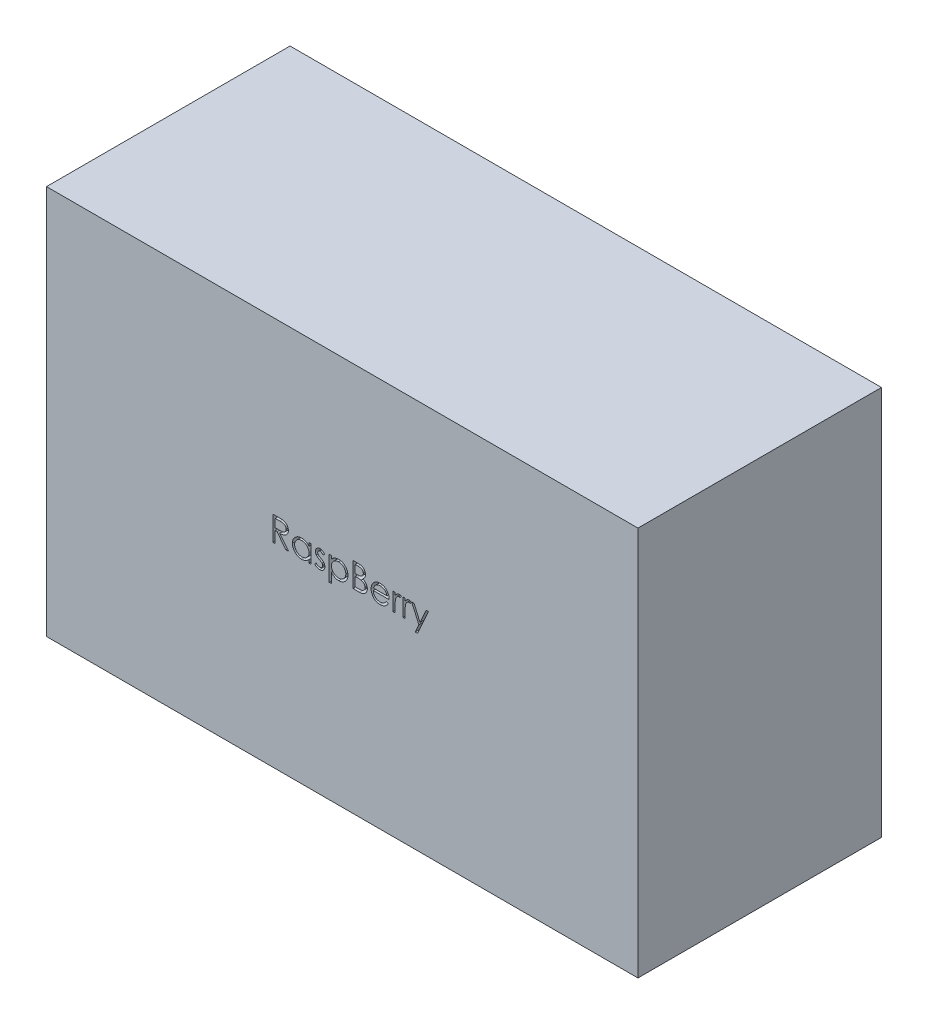
from build123d import *

# Parameters (mm, degrees)
CROQUIS1_W                 = 85
CROQUIS1_H                 = 56
SALIENTE_EXTRUIR2_DEPTH    = 17.5
CORTAR_EXTRUIR1_DEPTH      = 35
CORTAR_EXTRUIR1_DEPTH_BACK = 55


with BuildPart() as part:
    # Croquis1 → Saliente-Extruir2 (new, symmetric)
    with BuildSketch(Plane.XY):
        Rectangle(CROQUIS1_W, CROQUIS1_H)
    extrude(amount=SALIENTE_EXTRUIR2_DEPTH, both=True)

    # Croquis3 → Cortar-Extruir1 (cut, two sides: drawn at the far end of the back side and taken through both)
    # profile 1 of 9: a face of its own
    with BuildSketch(Plane.XY.offset(-CORTAR_EXTRUIR1_DEPTH_BACK)):
        with BuildLine():
            Line((-9.943123855, 3.5), (-9.242703182, 3.5))
            add(Edge.make_bspline(
                [(-9.242703182, 3.5), (-9.195962053, 3.499844414), (-9.106213909, 3.499545672), (-8.977640638, 3.497879909), (-8.860813541, 3.493105553), (-8.755793702, 3.48899697), (-8.662583047, 3.481505028), (-8.580895756, 3.474344381), (-8.511108059, 3.46497072), (-8.468862208, 3.456265297), (-8.449734432, 3.452323718)],
                knots=[0, 0, 0, 0, 1.410062039, 2.707475311, 3.878576406, 4.937260626, 5.877586885, 6.699081471, 7.410979367, 8, 8, 8, 8], degree=3))
            add(Edge.make_bspline(
                [(-8.449734432, 3.452323718), (-8.424127808, 3.445996953), (-8.373460818, 3.433478389), (-8.300510752, 3.407018788), (-8.230996428, 3.376399163), (-8.165206604, 3.340435443), (-8.103470813, 3.298860663), (-8.045152502, 3.252392541), (-7.989987038, 3.201285335), (-7.940205408, 3.144250494), (-7.893266357, 3.084413984), (-7.85367773, 3.019710227), (-7.81955125, 2.9520487), (-7.792380733, 2.880741282), (-7.77050276, 2.80647951), (-7.755076521, 2.728590713), (-7.745825333, 2.647429738), (-7.744883477, 2.59207183), (-7.744405906, 2.564002404)],
                knots=[0, 0, 0, 0, 1.027469482, 2.033020251, 3.019912614, 3.986113645, 4.951240523, 5.91722682, 6.890402269, 7.87763091, 8.8651537, 9.85103654, 10.82876324, 11.815024772, 12.821070561, 13.842952187, 14.906261191, 16, 16, 16, 16], degree=3))
            add(Edge.make_bspline(
                [(-7.744405906, 2.564002404), (-7.745874904, 2.517367299), (-7.7487413, 2.426370131), (-7.775466404, 2.29430925), (-7.819242923, 2.171119935), (-7.879566212, 2.056957297), (-7.956385688, 1.954046652), (-8.048710479, 1.863656197), (-8.156592091, 1.788016284), (-8.257021407, 1.735563479), (-8.345735606, 1.701970571), (-8.418768919, 1.678334212), (-8.498435897, 1.660072247), (-8.583973231, 1.643712115), (-8.675736887, 1.63136042), (-8.773506926, 1.622313826), (-8.877353078, 1.616659777), (-8.948692147, 1.615817772), (-8.985391483, 1.615384615)],
                knots=[0, 0, 0, 0, 1.260483769, 2.459530307, 3.627416485, 4.787058657, 5.939039949, 7.08810263, 8.267026773, 9.491475466, 10.141966685, 10.831826277, 11.566392101, 12.351337768, 13.187381173, 14.07005841, 15.007169909, 16, 16, 16, 16], degree=3))
            Line((-8.985391483, 1.615384615), (-7.699534111, 0))
            Line((-7.699534111, 0), (-8.087955586, 0))
            Line((-8.087955586, 0), (-9.373812957, 1.615384615))
            Line((-9.373812957, 1.615384615), (-9.629021291, 1.615384615))
            Line((-9.629021291, 1.615384615), (-9.629021291, 0))
            Line((-9.629021291, 0), (-9.943123855, 0))
            Line((-9.943123855, 0), (-9.943123855, 3.5))
        make_face()
        with BuildLine():
            Line((-9.629021291, 3.141025641), (-9.629021291, 1.974358974))
            Line((-9.629021291, 1.974358974), (-8.98819597, 1.969451122))
            add(Edge.make_bspline(
                [(-8.98819597, 1.969451122), (-8.958275931, 1.969437885), (-8.900282374, 1.969412229), (-8.816381709, 1.973406005), (-8.738261598, 1.977949323), (-8.666220846, 1.984898669), (-8.60022727, 1.99385474), (-8.540313857, 2.005057725), (-8.486382805, 2.018109787), (-8.423484267, 2.038311413), (-8.353247735, 2.070317431), (-8.276916275, 2.11688293), (-8.211913938, 2.175452049), (-8.156996075, 2.242425505), (-8.112866644, 2.316061754), (-8.08175459, 2.395478123), (-8.062012147, 2.478669721), (-8.059683602, 2.535847829), (-8.05850847, 2.564703526)],
                knots=[0, 0, 0, 0, 1.146690395, 2.22261258, 3.21895312, 4.145990853, 4.996080663, 5.770904154, 6.481378293, 7.121626537, 8.300444488, 9.431385265, 10.535395872, 11.636531494, 12.74115979, 13.810798291, 14.895190096, 16, 16, 16, 16], degree=3))
            add(Edge.make_bspline(
                [(-8.05850847, 2.564703526), (-8.059710591, 2.592850099), (-8.062092757, 2.648626338), (-8.081541525, 2.730282248), (-8.114430907, 2.807349198), (-8.158753144, 2.879513683), (-8.212752299, 2.945019419), (-8.276070112, 3.001066572), (-8.346975307, 3.047316037), (-8.413246506, 3.076870418), (-8.472480718, 3.094990271), (-8.523910378, 3.107741435), (-8.582021856, 3.117985904), (-8.647097315, 3.126193964), (-8.718858945, 3.133248909), (-8.797669596, 3.138000687), (-8.883006377, 3.140814551), (-8.942153308, 3.14095364), (-8.972771291, 3.141025641)],
                knots=[0, 0, 0, 0, 1.101028733, 2.181837193, 3.264309656, 4.369019818, 5.486613113, 6.575447106, 7.666700264, 8.788928104, 9.402425223, 10.0903467, 10.862060571, 11.710948788, 12.657782767, 13.684531032, 14.801375019, 16, 16, 16, 16], degree=3))
            Line((-8.972771291, 3.141025641), (-9.629021291, 3.141025641))
        make_face(mode=Mode.SUBTRACT)
    # profile 2 of 9: a face of its own
    with BuildSketch(Plane.XY.offset(-CORTAR_EXTRUIR1_DEPTH_BACK)):
        with BuildLine():
            Line((-4.46876488, 2.557692308), (-4.46876488, 0))
            Line((-4.46876488, 0), (-4.782867445, 0))
            Line((-4.782867445, 0), (-4.782867445, 0.442407853))
            add(Edge.make_bspline(
                [(-4.782867445, 0.442407853), (-4.818286235, 0.402368259), (-4.887406451, 0.324230488), (-5.002847568, 0.222148315), (-5.125215746, 0.137769993), (-5.253917068, 0.069620078), (-5.388835311, 0.018428021), (-5.529671398, -0.017958138), (-5.676482779, -0.041351973), (-5.776735134, -0.043687995), (-5.827538919, -0.044871795)],
                knots=[0, 0, 0, 0, 1.074387032, 2.096679803, 3.090159297, 4.057316773, 5.018401886, 5.985159533, 6.978961417, 8, 8, 8, 8], degree=3))
            add(Edge.make_bspline(
                [(-5.827538919, -0.044871795), (-5.872706873, -0.043645423), (-5.961780078, -0.041226962), (-6.092809155, -0.022464659), (-6.218901404, 0.007665963), (-6.340175977, 0.049566853), (-6.455848122, 0.105147674), (-6.566908219, 0.171688922), (-6.672780911, 0.250929752), (-6.77185245, 0.341517781), (-6.86308445, 0.439912768), (-6.943145723, 0.544858315), (-7.009898803, 0.655900619), (-7.065718884, 0.771633773), (-7.108715228, 0.892948692), (-7.138688862, 1.01942586), (-7.157429309, 1.150915734), (-7.15984677, 1.240455257), (-7.161072573, 1.285857372)],
                knots=[0, 0, 0, 0, 1.033919861, 2.038935746, 3.024066025, 3.998881131, 4.97069526, 5.957263378, 6.95902576, 7.993208707, 9.027059324, 10.027763471, 11.009749337, 11.988697705, 12.965288445, 13.950418724, 14.960734635, 16, 16, 16, 16], degree=3))
            add(Edge.make_bspline(
                [(-7.161072573, 1.285857372), (-7.159819601, 1.330321075), (-7.157342545, 1.418223419), (-7.138889325, 1.547502117), (-7.107858316, 1.672020377), (-7.064310468, 1.791377321), (-7.008468513, 1.905717371), (-6.940540426, 2.015121396), (-6.860521302, 2.119890793), (-6.768268895, 2.21756202), (-6.668334125, 2.307782634), (-6.561425394, 2.38619168), (-6.450202112, 2.453908529), (-6.332939102, 2.507562005), (-6.211371997, 2.550971109), (-6.084418551, 2.581004078), (-5.952606973, 2.598701399), (-5.86311648, 2.601264163), (-5.817723214, 2.602564103)],
                knots=[0, 0, 0, 0, 1.020392517, 2.01726096, 2.990465484, 3.961182959, 4.928053699, 5.906110375, 6.912531644, 7.948652711, 8.985773172, 9.998621852, 10.987621588, 11.969261332, 12.953316658, 13.946091881, 14.958173133, 16, 16, 16, 16], degree=3))
            add(Edge.make_bspline(
                [(-5.817723214, 2.602564103), (-5.765523355, 2.601126351), (-5.663161895, 2.598306988), (-5.513433886, 2.574844261), (-5.371789408, 2.535205794), (-5.237135056, 2.481288296), (-5.109954369, 2.409639567), (-4.991451385, 2.319259606), (-4.880385902, 2.210718419), (-4.81600561, 2.127347974), (-4.782867445, 2.084435096)],
                knots=[0, 0, 0, 0, 1.038897134, 2.037228247, 3.008116434, 3.962042015, 4.918381754, 5.904844433, 6.921570401, 8, 8, 8, 8], degree=3))
            Line((-4.782867445, 2.084435096), (-4.782867445, 2.557692308))
            Line((-4.782867445, 2.557692308), (-4.46876488, 2.557692308))
        make_face()
        with BuildLine():
            add(Edge.make_bspline(
                [(-5.813516483, 2.288461538), (-5.859430821, 2.286827901), (-5.950058421, 2.28360336), (-6.083102423, 2.258429865), (-6.210415837, 2.21654527), (-6.331361911, 2.159263369), (-6.444030128, 2.087234632), (-6.544723799, 2.000113249), (-6.6342665, 1.900276235), (-6.709574764, 1.788174125), (-6.770965261, 1.667996033), (-6.814132293, 1.542371595), (-6.842601541, 1.413566618), (-6.845510061, 1.326203932), (-6.846970009, 1.282351763)],
                knots=[0, 0, 0, 0, 1.031046209, 2.035121221, 3.029706178, 4.034933723, 5.034054252, 6.02443088, 7.017295772, 8.038157696, 9.050218397, 10.03989886, 11.016116709, 12, 12, 12, 12], degree=3))
            add(Edge.make_bspline(
                [(-6.846970009, 1.282351763), (-6.845105115, 1.238761656), (-6.841382639, 1.1517523), (-6.814631944, 1.022771723), (-6.769752071, 0.897117681), (-6.708510008, 0.775856687), (-6.631823383, 0.663272587), (-6.542934731, 0.561532464), (-6.440984449, 0.474042876), (-6.328056942, 0.400805303), (-6.207448972, 0.341642782), (-6.08061504, 0.300477142), (-5.949939402, 0.273899362), (-5.861087068, 0.270794885), (-5.81632097, 0.269230769)],
                knots=[0, 0, 0, 0, 0.979072187, 1.954306742, 2.945804271, 3.96968567, 4.997920485, 5.998718438, 6.996577872, 8.005894225, 9.015743152, 10.005417472, 10.995077863, 12, 12, 12, 12], degree=3))
            add(Edge.make_bspline(
                [(-5.81632097, 0.269230769), (-5.770874467, 0.270890733), (-5.680485881, 0.274192237), (-5.547047173, 0.299473502), (-5.41755221, 0.3412423), (-5.293764982, 0.399141427), (-5.178448851, 0.470898783), (-5.074950973, 0.554905874), (-4.987435005, 0.652609058), (-4.913242395, 0.759985511), (-4.855066978, 0.877697508), (-4.812690919, 1.003031698), (-4.787637014, 1.135992447), (-4.784479284, 1.226856374), (-4.782867445, 1.273237179)],
                knots=[0, 0, 0, 0, 1.01762866, 2.023962475, 3.030623092, 4.058876274, 5.077231937, 6.066672613, 7.034107872, 8.005628644, 8.981990164, 9.965428785, 10.961468474, 12, 12, 12, 12], degree=3))
            add(Edge.make_bspline(
                [(-4.782867445, 1.273237179), (-4.783827101, 1.30857501), (-4.785716008, 1.378131043), (-4.800146578, 1.480258561), (-4.823101504, 1.577992287), (-4.855447674, 1.671434976), (-4.897938959, 1.760069991), (-4.949186725, 1.844533752), (-5.010092174, 1.924386963), (-5.07967487, 1.998530034), (-5.155840073, 2.066156496), (-5.236434614, 2.126520737), (-5.322413361, 2.17610951), (-5.412330398, 2.217150781), (-5.506341732, 2.249809931), (-5.605212352, 2.271597625), (-5.707891339, 2.286557946), (-5.777937394, 2.287820327), (-5.813516483, 2.288461538)],
                knots=[0, 0, 0, 0, 1.050140795, 2.067009409, 3.05949893, 4.030605086, 5.00011959, 5.97591094, 6.962425594, 7.979863591, 8.993523472, 9.986985069, 10.967611495, 11.937549037, 12.921786183, 13.919465291, 14.943216303, 16, 16, 16, 16], degree=3))
        make_face(mode=Mode.SUBTRACT)
    # profile 3 of 9: a face of its own
    with BuildSketch(Plane.XY.offset(-CORTAR_EXTRUIR1_DEPTH_BACK)):
        with BuildLine():
            Line((-2.539277701, 2.238681891), (-2.752418727, 2.019230769))
            add(Edge.make_bspline(
                [(-2.752418727, 2.019230769), (-2.77080923, 2.040543916), (-2.806263956, 2.081633153), (-2.862495437, 2.136570219), (-2.918519041, 2.182707158), (-2.973567854, 2.221659417), (-3.029026123, 2.251108564), (-3.084243041, 2.272603426), (-3.13927578, 2.285905231), (-3.176061815, 2.28761967), (-3.194125457, 2.288461538)],
                knots=[0, 0, 0, 0, 1.26578478, 2.440284043, 3.530471711, 4.527705817, 5.468200915, 6.346673037, 7.188140097, 8, 8, 8, 8], degree=3))
            add(Edge.make_bspline(
                [(-3.194125457, 2.288461538), (-3.216264847, 2.287386665), (-3.259832033, 2.285271468), (-3.322257852, 2.264158037), (-3.380208477, 2.231749299), (-3.430365457, 2.185780715), (-3.472853137, 2.133016446), (-3.503866818, 2.074020122), (-3.522832801, 2.010572078), (-3.525237533, 1.96654222), (-3.526457188, 1.944210737)],
                knots=[0, 0, 0, 0, 0.99966794, 1.967205029, 2.953328237, 3.988086729, 5.028030931, 6.008226631, 6.989793394, 8, 8, 8, 8], degree=3))
            add(Edge.make_bspline(
                [(-3.526457188, 1.944210737), (-3.525346376, 1.923998693), (-3.523127883, 1.883631582), (-3.505881204, 1.824083548), (-3.478415131, 1.76602651), (-3.452744937, 1.730463604), (-3.439518086, 1.712139423)],
                knots=[0, 0, 0, 0, 0.960159726, 1.917612774, 2.927026955, 4, 4, 4, 4], degree=3))
            add(Edge.make_bspline(
                [(-3.439518086, 1.712139423), (-3.431554592, 1.702354839), (-3.414605299, 1.681529584), (-3.382796784, 1.652625731), (-3.346774281, 1.62068348), (-3.303454343, 1.588746643), (-3.254703316, 1.555114918), (-3.199464031, 1.521112785), (-3.139489526, 1.48414836), (-3.09655222, 1.460703924), (-3.07423363, 1.448517628)],
                knots=[0, 0, 0, 0, 0.66740084, 1.420478572, 2.27185888, 3.217733974, 4.268547843, 5.408967954, 6.65319498, 8, 8, 8, 8], degree=3))
            add(Edge.make_bspline(
                [(-3.07423363, 1.448517628), (-3.047020053, 1.433272725), (-2.994452383, 1.403824593), (-2.919759616, 1.358114889), (-2.851972575, 1.312683465), (-2.790516907, 1.268016191), (-2.736575099, 1.222863324), (-2.688510546, 1.178955567), (-2.647522102, 1.134966258), (-2.624568175, 1.104233145), (-2.613596611, 1.089543269)],
                knots=[0, 0, 0, 0, 1.27191281, 2.456916733, 3.569705269, 4.599008579, 5.553216877, 6.436649441, 7.252746552, 8, 8, 8, 8], degree=3))
            add(Edge.make_bspline(
                [(-2.613596611, 1.089543269), (-2.595386084, 1.059877181), (-2.559143755, 1.00083616), (-2.521085488, 0.903617733), (-2.499025213, 0.80050723), (-2.495962993, 0.72997501), (-2.494405906, 0.694110577)],
                knots=[0, 0, 0, 0, 0.995354457, 1.980940102, 2.973342416, 4, 4, 4, 4], degree=3))
            add(Edge.make_bspline(
                [(-2.494405906, 0.694110577), (-2.49512544, 0.668841431), (-2.49654336, 0.619045818), (-2.506401427, 0.545710988), (-2.523356403, 0.47557643), (-2.546450157, 0.407881146), (-2.57763453, 0.343922206), (-2.614182327, 0.282085957), (-2.658057239, 0.223710026), (-2.708148615, 0.168871066), (-2.762994109, 0.118785319), (-2.821500247, 0.074761365), (-2.883739078, 0.038187028), (-2.949265879, 0.007921682), (-3.018229533, -0.016146576), (-3.090640822, -0.032809107), (-3.166269577, -0.042781868), (-3.217699385, -0.044166344), (-3.243905105, -0.044871795)],
                knots=[0, 0, 0, 0, 1.032770009, 2.035186124, 3.017557409, 3.978232242, 4.952395191, 5.920591857, 6.910227898, 7.931268572, 8.952309245, 9.941945286, 10.918353717, 11.897095711, 12.887975737, 13.898235213, 14.929059601, 16, 16, 16, 16], degree=3))
            add(Edge.make_bspline(
                [(-3.243905105, -0.044871795), (-3.27927228, -0.043879095), (-3.349515207, -0.041907487), (-3.453404926, -0.023401426), (-3.554925685, 0.005393968), (-3.653309225, 0.045109902), (-3.746355339, 0.095260615), (-3.831486264, 0.155323008), (-3.908997726, 0.223313006), (-3.953116, 0.275425916), (-3.975175137, 0.301482372)],
                knots=[0, 0, 0, 0, 1.013940152, 2.01379169, 3.017749504, 4.037548394, 5.051665909, 6.043208538, 7.021604269, 8, 8, 8, 8], degree=3))
            Line((-3.975175137, 0.301482372), (-3.766941964, 0.538461538))
            add(Edge.make_bspline(
                [(-3.766941964, 0.538461538), (-3.747169551, 0.517106774), (-3.708837739, 0.475707334), (-3.647536522, 0.420582993), (-3.585157121, 0.374381722), (-3.522322434, 0.335738307), (-3.45810234, 0.305962904), (-3.392856726, 0.28504431), (-3.326718302, 0.271600118), (-3.282296166, 0.270021836), (-3.260030906, 0.269230769)],
                knots=[0, 0, 0, 0, 1.179806542, 2.287233372, 3.337373186, 4.324005949, 5.273901747, 6.200048787, 7.097828587, 8, 8, 8, 8], degree=3))
            add(Edge.make_bspline(
                [(-3.260030906, 0.269230769), (-3.22971298, 0.270601594), (-3.170476839, 0.273279956), (-3.08563308, 0.297597048), (-3.007294454, 0.335727), (-2.939271108, 0.389811698), (-2.881368947, 0.452767271), (-2.839440773, 0.52368139), (-2.813164597, 0.600472847), (-2.810078598, 0.653705149), (-2.80850847, 0.680789263)],
                knots=[0, 0, 0, 0, 1.072336372, 2.095165389, 3.102688358, 4.141489647, 5.156069229, 6.117746104, 7.042326257, 8, 8, 8, 8], degree=3))
            add(Edge.make_bspline(
                [(-2.80850847, 0.680789263), (-2.809594765, 0.703098881), (-2.811739507, 0.747146237), (-2.828582779, 0.810896578), (-2.855195632, 0.871365859), (-2.88140028, 0.906755506), (-2.894746451, 0.924779647)],
                knots=[0, 0, 0, 0, 1.013901739, 2.00181326, 2.98231254, 4, 4, 4, 4], degree=3))
            add(Edge.make_bspline(
                [(-2.894746451, 0.924779647), (-2.902768845, 0.93381501), (-2.920244518, 0.953497292), (-2.952299759, 0.98192237), (-2.990681621, 1.01256047), (-3.035821784, 1.044892059), (-3.087811246, 1.078490664), (-3.146860722, 1.113180016), (-3.212161274, 1.150607742), (-3.258331905, 1.175427397), (-3.282466804, 1.188401442)],
                knots=[0, 0, 0, 0, 0.615000592, 1.339693406, 2.178160186, 3.116406724, 4.166410947, 5.330106347, 6.604359322, 8, 8, 8, 8], degree=3))
            add(Edge.make_bspline(
                [(-3.282466804, 1.188401442), (-3.308513444, 1.202940574), (-3.359026191, 1.23113659), (-3.430573482, 1.275052671), (-3.495120836, 1.319719945), (-3.554221411, 1.362632784), (-3.606382417, 1.406053728), (-3.651398365, 1.45003098), (-3.691041581, 1.492790966), (-3.712988992, 1.523088263), (-3.723472413, 1.537560096)],
                knots=[0, 0, 0, 0, 1.262093308, 2.447601706, 3.550203992, 4.582594899, 5.537233252, 6.418365656, 7.244515135, 8, 8, 8, 8], degree=3))
            add(Edge.make_bspline(
                [(-3.723472413, 1.537560096), (-3.741603012, 1.566705711), (-3.777870547, 1.625007126), (-3.813085739, 1.722317603), (-3.837291767, 1.824762661), (-3.839454158, 1.895449515), (-3.840559752, 1.931590545)],
                knots=[0, 0, 0, 0, 0.985009483, 1.970363186, 2.962279964, 4, 4, 4, 4], degree=3))
            add(Edge.make_bspline(
                [(-3.840559752, 1.931590545), (-3.840025557, 1.955215943), (-3.838980061, 2.001454194), (-3.830636009, 2.069393014), (-3.815444298, 2.133941168), (-3.796389376, 2.196068031), (-3.769906371, 2.254570125), (-3.738260466, 2.310227596), (-3.701073041, 2.362963514), (-3.65822975, 2.411966646), (-3.611123105, 2.456475972), (-3.560228335, 2.4952746), (-3.506690079, 2.528380955), (-3.450281659, 2.556146116), (-3.390461186, 2.577147498), (-3.3276468, 2.591604883), (-3.261965645, 2.601260086), (-3.217064519, 2.602123171), (-3.194125457, 2.602564103)],
                knots=[0, 0, 0, 0, 1.087655834, 2.128696564, 3.144119009, 4.137814668, 5.115653402, 6.093965665, 7.082169637, 8.081268856, 9.086088321, 10.061021666, 11.022561449, 11.980240094, 12.950172527, 13.934149372, 14.944599409, 16, 16, 16, 16], degree=3))
            add(Edge.make_bspline(
                [(-3.194125457, 2.602564103), (-3.166933394, 2.601459762), (-3.112039172, 2.599230364), (-3.029684546, 2.581524674), (-2.947451204, 2.552391569), (-2.865127854, 2.512155336), (-2.783317565, 2.46008846), (-2.701300708, 2.397159161), (-2.618092678, 2.323781446), (-2.566136365, 2.267682221), (-2.539277701, 2.238681891)],
                knots=[0, 0, 0, 0, 0.845714091, 1.707292901, 2.609013841, 3.555613372, 4.552488639, 5.621697636, 6.770543573, 8, 8, 8, 8], degree=3))
        make_face()
    # profile 4 of 9: a face of its own
    with BuildSketch(Plane.XY.offset(-CORTAR_EXTRUIR1_DEPTH_BACK)):
        with BuildLine():
            Line((-1.866200778, 2.557692308), (-1.552098214, 2.557692308))
            Line((-1.552098214, 2.557692308), (-1.552098214, 2.084435096))
            add(Edge.make_bspline(
                [(-1.552098214, 2.084435096), (-1.51874073, 2.12737283), (-1.453917135, 2.210813723), (-1.34219223, 2.318803851), (-1.224265421, 2.409879155), (-1.097102009, 2.481261688), (-0.962678319, 2.5350825), (-0.821546001, 2.57486195), (-0.672507236, 2.598303424), (-0.570610784, 2.601125086), (-0.518644688, 2.602564103)],
                knots=[0, 0, 0, 0, 1.0828784, 2.104357462, 3.088488658, 4.04616522, 5.001424249, 5.969181776, 6.964304535, 8, 8, 8, 8], degree=3))
            add(Edge.make_bspline(
                [(-0.518644688, 2.602564103), (-0.473253085, 2.601250924), (-0.383534197, 2.598655357), (-0.251470968, 2.581082302), (-0.124295584, 2.55096461), (-0.00272753, 2.507563694), (0.114535535, 2.453908224), (0.225757635, 2.386191189), (0.33267119, 2.307784998), (0.432587379, 2.217552847), (0.524908747, 2.119924581), (0.604754928, 2.014902277), (0.673626832, 1.90593969), (0.729297129, 1.791347598), (0.772905476, 1.672028368), (0.803920154, 1.547499927), (0.822377797, 1.418223987), (0.824854249, 1.330321266), (0.826106914, 1.285857372)],
                knots=[0, 0, 0, 0, 1.041296284, 2.058176809, 3.050446431, 4.034000596, 5.01514041, 6.003636468, 7.015969324, 8.052561599, 9.08815499, 10.094063707, 11.074456064, 12.040834395, 13.011057502, 13.983766392, 14.980127149, 16, 16, 16, 16], degree=3))
            add(Edge.make_bspline(
                [(0.826106914, 1.285857372), (0.824881429, 1.240455063), (0.822464594, 1.150915159), (0.803719589, 1.019428062), (0.773762714, 0.892940688), (0.730704531, 0.771663424), (0.675063043, 0.655679773), (0.607358483, 0.545073377), (0.527472015, 0.439879674), (0.436170888, 0.341526774), (0.337117952, 0.250927461), (0.231240462, 0.171689391), (0.120181537, 0.105148016), (0.004509369, 0.049565056), (-0.116766269, 0.007672872), (-0.243079547, -0.022544929), (-0.374361693, -0.041179424), (-0.463662845, -0.043631567), (-0.508828983, -0.044871795)],
                knots=[0, 0, 0, 0, 1.038740735, 2.04854663, 3.033179607, 4.009277356, 4.987731542, 5.972001279, 6.972200261, 8.005528982, 9.039189865, 10.040446548, 11.026516639, 11.997840187, 12.972163198, 13.956796175, 14.96660207, 16, 16, 16, 16], degree=3))
            add(Edge.make_bspline(
                [(-0.508828983, -0.044871795), (-0.559656555, -0.043576987), (-0.660055911, -0.041019362), (-0.806853581, -0.015099952), (-0.948130433, 0.023636983), (-1.082321258, 0.080335977), (-1.210489071, 0.152591493), (-1.331908876, 0.240701699), (-1.447225629, 0.344482324), (-1.516634387, 0.42321414), (-1.552098214, 0.463441506)],
                knots=[0, 0, 0, 0, 1.014726462, 2.004382257, 2.969841629, 3.936926163, 4.907207904, 5.903978561, 6.929055279, 8, 8, 8, 8], degree=3))
            Line((-1.552098214, 0.463441506), (-1.552098214, -0.942307692))
            Line((-1.552098214, -0.942307692), (-1.866200778, -0.942307692))
            Line((-1.866200778, -0.942307692), (-1.866200778, 2.557692308))
        make_face()
        with BuildLine():
            add(Edge.make_bspline(
                [(-0.521449175, 2.288461538), (-0.557028738, 2.28782128), (-0.627075726, 2.286560777), (-0.729747945, 2.271586828), (-0.828643372, 2.249849087), (-0.922765324, 2.216937187), (-1.01301594, 2.176538373), (-1.098700105, 2.126056362), (-1.179757673, 2.066404356), (-1.255984703, 1.998725013), (-1.324847996, 1.924150324), (-1.385810924, 1.844562515), (-1.437018229, 1.760062376), (-1.47952025, 1.671437013), (-1.511863532, 1.577991728), (-1.534819252, 1.480258715), (-1.549249605, 1.378131003), (-1.551138542, 1.308574996), (-1.552098214, 1.273237179)],
                knots=[0, 0, 0, 0, 1.05670511, 2.080379991, 3.077984906, 4.06214886, 5.038337365, 6.01289324, 7.01187578, 8.025460281, 9.038092164, 10.024533457, 11.000252242, 11.969694649, 12.940728589, 13.933144304, 14.949937299, 16, 16, 16, 16], degree=3))
            add(Edge.make_bspline(
                [(-1.552098214, 1.273237179), (-1.550507358, 1.226849067), (-1.547390736, 1.135970826), (-1.522053368, 1.003186704), (-1.480818104, 0.877535048), (-1.42228939, 0.760074011), (-1.348341816, 0.652091176), (-1.25924366, 0.55540057), (-1.155801109, 0.470609979), (-1.039733917, 0.399188725), (-0.915311786, 0.341200659), (-0.785525874, 0.299686448), (-0.652160993, 0.27411422), (-0.561992673, 0.270867401), (-0.516541323, 0.269230769)],
                knots=[0, 0, 0, 0, 1.03728447, 2.032128127, 3.01272805, 3.987917167, 4.958271349, 5.931593992, 6.91984656, 7.941419022, 8.973179163, 9.983609215, 10.983593296, 12, 12, 12, 12], degree=3))
            add(Edge.make_bspline(
                [(-0.516541323, 0.269230769), (-0.472005555, 0.270787146), (-0.383610062, 0.273876274), (-0.25345194, 0.300614462), (-0.126961302, 0.341459487), (-0.00678113, 0.401019043), (0.106042358, 0.474009101), (0.207923912, 0.561569134), (0.296930825, 0.663059077), (0.37279518, 0.77606758), (0.433926666, 0.897242964), (0.479856906, 1.022624353), (0.506365479, 1.151769776), (0.510122267, 1.238767489), (0.51200435, 1.282351763)],
                knots=[0, 0, 0, 0, 1.00104056, 1.986885549, 2.97790532, 3.984399681, 4.995088187, 5.994304198, 6.996462723, 8.023150851, 9.048424203, 10.043036403, 11.019596776, 12, 12, 12, 12], degree=3))
            add(Edge.make_bspline(
                [(0.51200435, 1.282351763), (0.510549616, 1.326206752), (0.507651483, 1.413575056), (0.479104445, 1.542337959), (0.436204467, 1.668225935), (0.373645415, 1.787746484), (0.299444146, 1.900520567), (0.209697149, 2.000074446), (0.109080952, 2.087245119), (-0.003608212, 2.159260529), (-0.124548637, 2.216546024), (-0.251863553, 2.258429663), (-0.384907155, 2.283603412), (-0.47553481, 2.286827918), (-0.521449175, 2.288461538)],
                knots=[0, 0, 0, 0, 0.983928682, 1.960191568, 2.949917689, 3.96440592, 4.982380491, 5.975291189, 6.965713506, 7.964880129, 8.970154049, 9.96478489, 10.968906225, 12, 12, 12, 12], degree=3))
        make_face(mode=Mode.SUBTRACT)
    # profile 5 of 9: a face of its own
    with BuildSketch(Plane.XY.offset(-CORTAR_EXTRUIR1_DEPTH_BACK)):
        with BuildLine():
            Line((1.544055632, 3.5), (2.226948261, 3.5))
            add(Edge.make_bspline(
                [(2.226948261, 3.5), (2.260376739, 3.49982425), (2.325169449, 3.499483602), (2.419388891, 3.49420047), (2.507637702, 3.486996801), (2.589941474, 3.475566708), (2.666262176, 3.461774931), (2.736829814, 3.445073115), (2.801419986, 3.425046501), (2.878532722, 3.39320022), (2.966453383, 3.345877051), (3.061651776, 3.275948486), (3.143056015, 3.190416023), (3.213242332, 3.093933368), (3.269043452, 2.987797596), (3.309412749, 2.874538407), (3.334970625, 2.755616665), (3.337599059, 2.673973487), (3.338927427, 2.63271234)],
                knots=[0, 0, 0, 0, 1.001505555, 1.941167018, 2.826882275, 3.653841531, 4.429895133, 5.150066043, 5.825578002, 6.45369114, 7.647487171, 8.808567382, 9.977351308, 11.170798116, 12.373658725, 13.556498008, 14.765093433, 16, 16, 16, 16], degree=3))
            add(Edge.make_bspline(
                [(3.338927427, 2.63271234), (3.337834209, 2.594059784), (3.335685931, 2.518103867), (3.315143172, 2.407009758), (3.282982504, 2.301258539), (3.238277254, 2.201236154), (3.180175258, 2.10920254), (3.11131694, 2.024415274), (3.028240137, 1.950464217), (2.965996897, 1.909121315), (2.934380152, 1.888120994)],
                knots=[0, 0, 0, 0, 1.044552857, 2.05264487, 3.044412934, 4.028983338, 5.005914585, 5.980388656, 6.974128949, 8, 8, 8, 8], degree=3))
            add(Edge.make_bspline(
                [(2.934380152, 1.888120994), (2.974140579, 1.872855995), (3.050212127, 1.84365027), (3.154898139, 1.792014806), (3.245092984, 1.735852696), (3.32149013, 1.674520846), (3.386827785, 1.608412035), (3.443880726, 1.536556921), (3.492562101, 1.458018163), (3.534275024, 1.373614627), (3.56682378, 1.284208159), (3.591199685, 1.190637383), (3.605167134, 1.093237828), (3.607154775, 1.026952448), (3.608158196, 0.993489583)],
                knots=[0, 0, 0, 0, 1.27268992, 2.434971085, 3.483601985, 4.442670788, 5.356604649, 6.2567628, 7.179492994, 8.113709626, 9.066344395, 10.018646069, 10.999752585, 12, 12, 12, 12], degree=3))
            add(Edge.make_bspline(
                [(3.608158196, 0.993489583), (3.60718135, 0.959322711), (3.605259378, 0.892098433), (3.591079407, 0.793343299), (3.5670703, 0.698968352), (3.533999153, 0.608363169), (3.490836839, 0.521703035), (3.438308874, 0.438889771), (3.375677311, 0.36075544), (3.305614442, 0.286431817), (3.226352296, 0.21960403), (3.140836541, 0.160088323), (3.047990222, 0.111142261), (2.949338228, 0.070026239), (2.843773911, 0.038619041), (2.731771304, 0.016646467), (2.613427002, 0.00184143), (2.532217251, 0.000624225), (2.490570055, 0)],
                knots=[0, 0, 0, 0, 0.978564426, 1.925352924, 2.850884081, 3.763762016, 4.682927383, 5.618979971, 6.567305752, 7.547517671, 8.540179244, 9.531824382, 10.526200242, 11.540722885, 12.589160233, 13.674978461, 14.80764778, 16, 16, 16, 16], degree=3))
            Line((2.490570055, 0), (1.544055632, 0))
            Line((1.544055632, 0), (1.544055632, 3.5))
        make_face()
        with BuildLine():
            Line((1.858158196, 3.141025641), (1.858158196, 2.019230769))
            Line((1.858158196, 2.019230769), (2.069195857, 2.019230769))
            add(Edge.make_bspline(
                [(2.069195857, 2.019230769), (2.100044652, 2.019630692), (2.159650811, 2.020403425), (2.245970708, 2.022616942), (2.326095726, 2.028814985), (2.399887559, 2.035011248), (2.467230003, 2.045085835), (2.527973865, 2.057077958), (2.583072462, 2.069760863), (2.646612007, 2.09133035), (2.718684956, 2.123208025), (2.79551806, 2.172679861), (2.863252529, 2.231604215), (2.920449717, 2.299595176), (2.967261188, 2.374461362), (2.999774903, 2.455008243), (3.021822187, 2.539228375), (3.023813718, 2.597046627), (3.024824863, 2.626402244)],
                knots=[0, 0, 0, 0, 1.156816544, 2.235205308, 3.236616184, 4.169592532, 5.011045266, 5.787822928, 6.49130361, 7.128639758, 8.301311294, 9.436451833, 10.541879658, 11.654887649, 12.756523258, 13.837046038, 14.901820046, 16, 16, 16, 16], degree=3))
            add(Edge.make_bspline(
                [(3.024824863, 2.626402244), (3.024298683, 2.645828015), (3.023266523, 2.683933787), (3.01481322, 2.739483141), (3.000445646, 2.791726894), (2.981991353, 2.841381004), (2.956202664, 2.886892854), (2.925839201, 2.92983605), (2.88915351, 2.968748169), (2.847396198, 3.005117667), (2.799387575, 3.037362195), (2.745156283, 3.065602958), (2.683968606, 3.088343735), (2.616855751, 3.108259887), (2.542784664, 3.122248181), (2.46261011, 3.133901569), (2.375675391, 3.139834311), (2.315530289, 3.140619673), (2.284440248, 3.141025641)],
                knots=[0, 0, 0, 0, 0.91205012, 1.789085906, 2.630437955, 3.453916878, 4.269457761, 5.079663411, 5.91843418, 6.774407191, 7.675494373, 8.627863946, 9.638891023, 10.736472738, 11.911756761, 13.175263542, 14.539845004, 16, 16, 16, 16], degree=3))
            Line((2.284440248, 3.141025641), (1.858158196, 3.141025641))
        make_face(mode=Mode.SUBTRACT)
        with BuildLine():
            Line((1.858158196, 1.66025641), (1.858158196, 0.358974359))
            Line((1.858158196, 0.358974359), (2.305473902, 0.358974359))
            add(Edge.make_bspline(
                [(2.305473902, 0.358974359), (2.337492827, 0.359358106), (2.399205086, 0.360097729), (2.488306316, 0.362512283), (2.57088942, 0.368004559), (2.646577556, 0.376650409), (2.716188008, 0.386028858), (2.778885711, 0.398640139), (2.835178905, 0.413089099), (2.900453213, 0.435423272), (2.973956721, 0.470119743), (3.053167577, 0.522433969), (3.123593795, 0.584757277), (3.183399055, 0.656888191), (3.232412043, 0.735319518), (3.268067498, 0.818464868), (3.290058355, 0.904950395), (3.292720524, 0.963917108), (3.294055632, 0.993489583)],
                knots=[0, 0, 0, 0, 1.160039823, 2.235823828, 3.228722157, 4.157150951, 4.99529583, 5.772374946, 6.472645482, 7.099169577, 8.269452708, 9.405989375, 10.527446681, 11.663510218, 12.788923519, 13.866172445, 14.929861265, 16, 16, 16, 16], degree=3))
            add(Edge.make_bspline(
                [(3.294055632, 0.993489583), (3.293779528, 1.011982924), (3.293231773, 1.048671306), (3.284971158, 1.102587125), (3.272957288, 1.154812998), (3.257425854, 1.205490739), (3.234806387, 1.253704115), (3.208399842, 1.300406674), (3.177438441, 1.345660154), (3.129194275, 1.402872407), (3.05902229, 1.46878942), (2.959315515, 1.533326923), (2.845943217, 1.58537473), (2.763715724, 1.607474206), (2.721239126, 1.618890224)],
                knots=[0, 0, 0, 0, 0.723448775, 1.435228256, 2.130040452, 2.821711965, 3.505591119, 4.210454504, 4.921174351, 5.648778258, 7.137944449, 8.670945889, 10.280296675, 12, 12, 12, 12], degree=3))
            add(Edge.make_bspline(
                [(2.721239126, 1.618890224), (2.70421003, 1.622345308), (2.667287438, 1.629836643), (2.607079857, 1.637744346), (2.538343988, 1.644789406), (2.460921111, 1.650000564), (2.37471327, 1.655387107), (2.279536351, 1.657481929), (2.175779037, 1.659981189), (2.103786664, 1.660162323), (2.06639137, 1.66025641)],
                knots=[0, 0, 0, 0, 0.634451884, 1.375622551, 2.216452059, 3.157844607, 4.20941857, 5.370758133, 6.634282058, 8, 8, 8, 8], degree=3))
            Line((2.06639137, 1.66025641), (1.858158196, 1.66025641))
        make_face(mode=Mode.SUBTRACT)
    # profile 6 of 9: a face of its own
    with BuildSketch(Plane.XY.offset(-CORTAR_EXTRUIR1_DEPTH_BACK)):
        with BuildLine():
            Line((6.335521978, 0.807692308), (6.614568453, 0.661157853))
            add(Edge.make_bspline(
                [(6.614568453, 0.661157853), (6.592331858, 0.621714521), (6.549068249, 0.544973418), (6.474667501, 0.439541558), (6.396675429, 0.344693842), (6.311571461, 0.262964188), (6.221901782, 0.191712803), (6.127169127, 0.129374978), (6.026880309, 0.076256458), (5.921030584, 0.03150393), (5.808731033, -0.002905564), (5.689709517, -0.027209785), (5.563738021, -0.042233054), (5.477391842, -0.043978194), (5.433178228, -0.044871795)],
                knots=[0, 0, 0, 0, 1.120438281, 2.179929193, 3.190490725, 4.156257408, 5.095198341, 6.022838206, 6.959905092, 7.901321166, 8.864066838, 9.862729781, 10.905609505, 12, 12, 12, 12], degree=3))
            add(Edge.make_bspline(
                [(5.433178228, -0.044871795), (5.384036251, -0.04372462), (5.288174489, -0.041486813), (5.148634742, -0.022194348), (5.017255324, 0.00927801), (4.89404362, 0.053243552), (4.779301368, 0.110670876), (4.672800513, 0.180630358), (4.573980987, 0.262762612), (4.485956778, 0.357779056), (4.406712895, 0.459461013), (4.336787075, 0.565416898), (4.278329644, 0.675380122), (4.230777034, 0.788650646), (4.192372169, 0.90451454), (4.165605465, 1.024026007), (4.150175717, 1.146861592), (4.147811272, 1.229958927), (4.146619735, 1.271834936)],
                knots=[0, 0, 0, 0, 1.145258523, 2.234067595, 3.276747158, 4.290159414, 5.277019952, 6.260822364, 7.254936242, 8.264827045, 9.274100331, 10.257902744, 11.220704747, 12.172965371, 13.118907548, 14.062713208, 15.023725156, 16, 16, 16, 16], degree=3))
            add(Edge.make_bspline(
                [(4.146619735, 1.271834936), (4.147678876, 1.311129766), (4.149777954, 1.389006931), (4.163008742, 1.504272476), (4.186457035, 1.616300928), (4.218633359, 1.725185376), (4.260184605, 1.83074351), (4.311016824, 1.933039574), (4.371209202, 2.031964713), (4.417681876, 2.094367847), (4.441090889, 2.125801282)],
                knots=[0, 0, 0, 0, 1.024358464, 2.0301432, 3.019427413, 4.004406732, 4.986367066, 5.972626655, 6.978780325, 8, 8, 8, 8], degree=3))
            add(Edge.make_bspline(
                [(4.441090889, 2.125801282), (4.472798572, 2.163670152), (4.535209518, 2.238208303), (4.640765873, 2.336146628), (4.75506607, 2.418190404), (4.876677696, 2.48619754), (5.00701417, 2.537871187), (5.144323461, 2.576378769), (5.290169047, 2.59795678), (5.389874268, 2.601004614), (5.440890568, 2.602564103)],
                knots=[0, 0, 0, 0, 1.030682036, 2.02871468, 2.997146059, 3.962720338, 4.930598197, 5.918074684, 6.934738563, 8, 8, 8, 8], degree=3))
            add(Edge.make_bspline(
                [(5.440890568, 2.602564103), (5.493338174, 2.601210054), (5.596228419, 2.598553718), (5.746260541, 2.573927385), (5.888221257, 2.53487483), (6.022053761, 2.47972104), (6.147771622, 2.408561488), (6.264557672, 2.320419647), (6.374409184, 2.218001559), (6.438317763, 2.13923835), (6.470838485, 2.099158654)],
                knots=[0, 0, 0, 0, 1.056321875, 2.072262726, 3.055038591, 4.01806755, 4.982017516, 5.957941055, 6.960871419, 8, 8, 8, 8], degree=3))
            add(Edge.make_bspline(
                [(6.470838485, 2.099158654), (6.492965423, 2.068955072), (6.537072016, 2.008748954), (6.592319116, 1.910577797), (6.640276511, 1.807867202), (6.678609472, 1.698956905), (6.709648974, 1.585137325), (6.732105792, 1.46559478), (6.745275411, 1.340364869), (6.747864108, 1.255038314), (6.749183837, 1.211538462)],
                knots=[0, 0, 0, 0, 0.94817472, 1.890038105, 2.849395472, 3.817997239, 4.812318967, 5.836947057, 6.897266129, 8, 8, 8, 8], degree=3))
            Line((6.749183837, 1.211538462), (4.460722299, 1.211538462))
            add(Edge.make_bspline(
                [(4.460722299, 1.211538462), (4.462261905, 1.177837997), (4.465289479, 1.111567394), (4.479404623, 1.01459661), (4.501653396, 0.922223268), (4.532922459, 0.835140226), (4.570789304, 0.752210099), (4.617175021, 0.674048062), (4.672514575, 0.601010132), (4.734240274, 0.532442994), (4.80294737, 0.471382233), (4.875230117, 0.416730457), (4.952123682, 0.37092486), (5.033021765, 0.33374497), (5.117793551, 0.304638654), (5.206465746, 0.284770834), (5.298863862, 0.271463727), (5.361849596, 0.269984061), (5.393915408, 0.269230769)],
                knots=[0, 0, 0, 0, 1.094153842, 2.151609401, 3.174256925, 4.172055639, 5.149267565, 6.128595816, 7.11444997, 8.118368179, 9.117203808, 10.09244225, 11.054858984, 12.015122123, 12.976791628, 13.957293641, 14.960065497, 16, 16, 16, 16], degree=3))
            add(Edge.make_bspline(
                [(5.393915408, 0.269230769), (5.425266556, 0.269838826), (5.487473246, 0.271045327), (5.580114104, 0.282777238), (5.671253631, 0.301747513), (5.760514615, 0.327637504), (5.84608546, 0.359214356), (5.92533101, 0.397317213), (5.998211226, 0.43946696), (6.066328193, 0.487676635), (6.132399186, 0.546684822), (6.197941672, 0.620320543), (6.268218326, 0.707408071), (6.312207919, 0.772953737), (6.335521978, 0.807692308)],
                knots=[0, 0, 0, 0, 0.99110716, 1.966546729, 2.947904876, 3.932708344, 4.903319531, 5.828989031, 6.710028674, 7.56322171, 8.463672341, 9.504779593, 10.677557249, 12, 12, 12, 12], degree=3))
        make_face()
        with BuildLine():
            add(Edge.make_bspline(
                [(6.435081273, 1.525641026), (6.423584649, 1.567303899), (6.401457347, 1.64749152), (6.355220983, 1.75853241), (6.303149442, 1.857220311), (6.241527711, 1.942799944), (6.171708985, 2.018803457), (6.091063803, 2.085222043), (6.000627909, 2.144639494), (5.900868768, 2.194791993), (5.795226983, 2.237481852), (5.684620791, 2.266106968), (5.571763003, 2.28571651), (5.495428717, 2.287542618), (5.45701637, 2.288461538)],
                knots=[0, 0, 0, 0, 1.154881502, 2.222775134, 3.210006277, 4.132804581, 5.035138423, 5.962687519, 6.919655026, 7.923214229, 8.944639381, 9.960483929, 10.97369054, 12, 12, 12, 12], degree=3))
            add(Edge.make_bspline(
                [(5.45701637, 2.288461538), (5.425666931, 2.287849867), (5.363695682, 2.286640721), (5.272394614, 2.275170592), (5.184714915, 2.256210747), (5.100009627, 2.23024579), (5.019388759, 2.195637188), (4.941193991, 2.155053961), (4.867413594, 2.105512377), (4.821272299, 2.067753522), (4.797961882, 2.048677885)],
                knots=[0, 0, 0, 0, 1.04873581, 2.073130211, 3.073294108, 4.04793562, 5.032784715, 6.005352987, 6.992311501, 8, 8, 8, 8], degree=3))
            add(Edge.make_bspline(
                [(4.797961882, 2.048677885), (4.7812686, 2.033583569), (4.747485466, 2.003036353), (4.702344945, 1.950407146), (4.659124472, 1.893655584), (4.619790819, 1.83061046), (4.583713233, 1.761989681), (4.549953256, 1.688372045), (4.519566843, 1.609198915), (4.502470733, 1.554026476), (4.493675023, 1.525641026)],
                knots=[0, 0, 0, 0, 0.879870761, 1.780643979, 2.707998968, 3.669668524, 4.684282772, 5.740141944, 6.837334558, 8, 8, 8, 8], degree=3))
            Line((4.493675023, 1.525641026), (6.435081273, 1.525641026))
        make_face(mode=Mode.SUBTRACT)
    # profile 7 of 9: a face of its own
    with BuildSketch(Plane.XY.offset(-CORTAR_EXTRUIR1_DEPTH_BACK)):
        with BuildLine():
            Line((7.287645376, 2.557692308), (7.60174794, 2.557692308))
            Line((7.60174794, 2.557692308), (7.60174794, 2.181189904))
            add(Edge.make_bspline(
                [(7.60174794, 2.181189904), (7.624936699, 2.216245732), (7.66928502, 2.283289731), (7.742997949, 2.371959032), (7.81850128, 2.445374079), (7.896156468, 2.503877598), (7.976534568, 2.547690717), (8.057871519, 2.579783752), (8.141446989, 2.598761067), (8.197608913, 2.601294726), (8.225746337, 2.602564103)],
                knots=[0, 0, 0, 0, 1.2804753, 2.448899062, 3.506932113, 4.484331642, 5.4025378, 6.288909075, 7.142734305, 8, 8, 8, 8], degree=3))
            add(Edge.make_bspline(
                [(8.225746337, 2.602564103), (8.247572664, 2.601373576), (8.292481749, 2.59892399), (8.360464339, 2.581713165), (8.430507791, 2.554235143), (8.475650178, 2.52839492), (8.499183837, 2.514923878)],
                knots=[0, 0, 0, 0, 0.901110191, 1.854092781, 2.881294221, 4, 4, 4, 4], degree=3))
            Line((8.499183837, 2.514923878), (8.326707876, 2.242888622))
            add(Edge.make_bspline(
                [(8.326707876, 2.242888622), (8.311598855, 2.249628888), (8.28291904, 2.262423203), (8.240964474, 2.277565213), (8.202283137, 2.286481129), (8.177639579, 2.287831847), (8.166150985, 2.288461538)],
                knots=[0, 0, 0, 0, 1.180555205, 2.24091978, 3.179933427, 4, 4, 4, 4], degree=3))
            add(Edge.make_bspline(
                [(8.166150985, 2.288461538), (8.140945251, 2.286781501), (8.089532861, 2.283354712), (8.014048362, 2.256415904), (7.940801157, 2.212890664), (7.882629494, 2.164619552), (7.837587241, 2.118071755), (7.805447016, 2.077423352), (7.775964269, 2.031844721), (7.747794048, 1.982115037), (7.722127754, 1.927385191), (7.698173085, 1.868201977), (7.676514222, 1.804496849), (7.664163978, 1.760114328), (7.657837684, 1.737379808)],
                knots=[0, 0, 0, 0, 1.125678352, 2.296057538, 3.5422874, 4.923748041, 5.663163013, 6.437101912, 7.23742474, 8.08941207, 8.991984279, 9.93940061, 10.944477711, 12, 12, 12, 12], degree=3))
            add(Edge.make_bspline(
                [(7.657837684, 1.737379808), (7.65310529, 1.717102634), (7.642623399, 1.672190235), (7.632431861, 1.596841711), (7.622362343, 1.507818052), (7.615265724, 1.404871459), (7.608687682, 1.288259015), (7.6049776, 1.15780307), (7.601874459, 1.013369718), (7.601791393, 0.912395365), (7.60174794, 0.859575321)],
                knots=[0, 0, 0, 0, 0.566838948, 1.255505196, 2.06880316, 3.007127437, 4.065329342, 5.249902469, 6.561414163, 8, 8, 8, 8], degree=3))
            Line((7.60174794, 0.859575321), (7.60174794, 0))
            Line((7.60174794, 0), (7.287645376, 0))
            Line((7.287645376, 0), (7.287645376, 2.557692308))
        make_face()
    # profile 8 of 9: a face of its own
    with BuildSketch(Plane.XY.offset(-CORTAR_EXTRUIR1_DEPTH_BACK)):
        with BuildLine():
            Line((8.723542812, 2.557692308), (9.037645376, 2.557692308))
            Line((9.037645376, 2.557692308), (9.037645376, 2.181189904))
            add(Edge.make_bspline(
                [(9.037645376, 2.181189904), (9.060834135, 2.216245732), (9.105182456, 2.283289731), (9.178895385, 2.371959032), (9.254398716, 2.445374079), (9.332053904, 2.503877598), (9.412432003, 2.547690717), (9.493768955, 2.579783752), (9.577344425, 2.598761067), (9.633506349, 2.601294726), (9.661643773, 2.602564103)],
                knots=[0, 0, 0, 0, 1.2804753, 2.448899062, 3.506932113, 4.484331642, 5.4025378, 6.288909075, 7.142734305, 8, 8, 8, 8], degree=3))
            add(Edge.make_bspline(
                [(9.661643773, 2.602564103), (9.6834701, 2.601373576), (9.728379185, 2.59892399), (9.796361775, 2.581713165), (9.866405227, 2.554235143), (9.911547614, 2.52839492), (9.935081273, 2.514923878)],
                knots=[0, 0, 0, 0, 0.901110191, 1.854092781, 2.881294221, 4, 4, 4, 4], degree=3))
            Line((9.935081273, 2.514923878), (9.762605312, 2.242888622))
            add(Edge.make_bspline(
                [(9.762605312, 2.242888622), (9.747496291, 2.249628888), (9.718816476, 2.262423203), (9.67686191, 2.277565213), (9.638180573, 2.286481129), (9.613537015, 2.287831847), (9.602048421, 2.288461538)],
                knots=[0, 0, 0, 0, 1.180555205, 2.24091978, 3.179933427, 4, 4, 4, 4], degree=3))
            add(Edge.make_bspline(
                [(9.602048421, 2.288461538), (9.576842687, 2.286781501), (9.525430297, 2.283354712), (9.449945798, 2.256415904), (9.376698592, 2.212890664), (9.31852693, 2.164619552), (9.273484677, 2.118071755), (9.241344452, 2.077423352), (9.211861705, 2.031844721), (9.183691484, 1.982115037), (9.15802519, 1.927385191), (9.134070521, 1.868201977), (9.112411658, 1.804496849), (9.100061414, 1.760114328), (9.09373512, 1.737379808)],
                knots=[0, 0, 0, 0, 1.125678352, 2.296057538, 3.5422874, 4.923748041, 5.663163013, 6.437101912, 7.23742474, 8.08941207, 8.991984279, 9.93940061, 10.944477711, 12, 12, 12, 12], degree=3))
            add(Edge.make_bspline(
                [(9.09373512, 1.737379808), (9.089002726, 1.717102634), (9.078520834, 1.672190235), (9.068329297, 1.596841711), (9.058259779, 1.507818052), (9.05116316, 1.404871459), (9.044585118, 1.288259015), (9.040875036, 1.15780307), (9.037771895, 1.013369718), (9.037688828, 0.912395365), (9.037645376, 0.859575321)],
                knots=[0, 0, 0, 0, 0.566838948, 1.255505196, 2.06880316, 3.007127437, 4.065329342, 5.249902469, 6.561414163, 8, 8, 8, 8], degree=3))
            Line((9.037645376, 0.859575321), (9.037645376, 0))
            Line((9.037645376, 0), (8.723542812, 0))
            Line((8.723542812, 0), (8.723542812, 2.557692308))
        make_face()
    # profile 9 of 9: a face of its own
    with BuildSketch(Plane.XY.offset(-CORTAR_EXTRUIR1_DEPTH_BACK)):
        Polygon((9.979953068, 2.557692308), (10.318594895, 2.557692308), (11.184480312, 0.598758013), (12.063687043, 2.557692308), (12.403029991, 2.557692308), (10.832517171, -0.942307692), (10.493174222, -0.942307692), (11.014107716, 0.218048878), align=None)
    extrude(amount=CORTAR_EXTRUIR1_DEPTH + CORTAR_EXTRUIR1_DEPTH_BACK, mode=Mode.SUBTRACT)


with BuildPart() as cortar_extruir1_piece_1:
    # of the separate pieces the step leaves, piece 1, a body of its own (cortar_extruir1_pieces)
    add(part.part.solids().sort_by_distance((-42.5, -28, -17.5))[0])


with BuildPart() as cortar_extruir1_piece_2:
    # of the separate pieces the step leaves, piece 2, a body of its own (cortar_extruir1_pieces)
    add(part.part.solids().sort_by_distance((-5.813516483, 2.288461538, -17.5))[0])


with BuildPart() as cortar_extruir1_piece_3:
    # of the separate pieces the step leaves, piece 3, a body of its own (cortar_extruir1_pieces)
    add(part.part.solids().sort_by_distance((-0.521449175, 2.288461538, -17.5))[0])


with BuildPart() as cortar_extruir1_piece_4:
    # of the separate pieces the step leaves, piece 4, a body of its own (cortar_extruir1_pieces)
    add(part.part.solids().sort_by_distance((-9.629021291, 3.141025641, -17.5))[0])


with BuildPart() as cortar_extruir1_piece_5:
    # of the separate pieces the step leaves, piece 5, a body of its own (cortar_extruir1_pieces)
    add(part.part.solids().sort_by_distance((1.858158196, 1.66025641, -17.5))[0])


with BuildPart() as cortar_extruir1_piece_6:
    # of the separate pieces the step leaves, piece 6, a body of its own (cortar_extruir1_pieces)
    add(part.part.solids().sort_by_distance((1.858158196, 3.141025641, -17.5))[0])


with BuildPart() as cortar_extruir1_piece_7:
    # of the separate pieces the step leaves, piece 7, a body of its own (cortar_extruir1_pieces)
    add(part.part.solids().sort_by_distance((6.435081273, 1.525641026, -17.5))[0])


solid = Compound([cortar_extruir1_piece_1.part, cortar_extruir1_piece_2.part, cortar_extruir1_piece_3.part, cortar_extruir1_piece_4.part, cortar_extruir1_piece_5.part, cortar_extruir1_piece_6.part, cortar_extruir1_piece_7.part])
